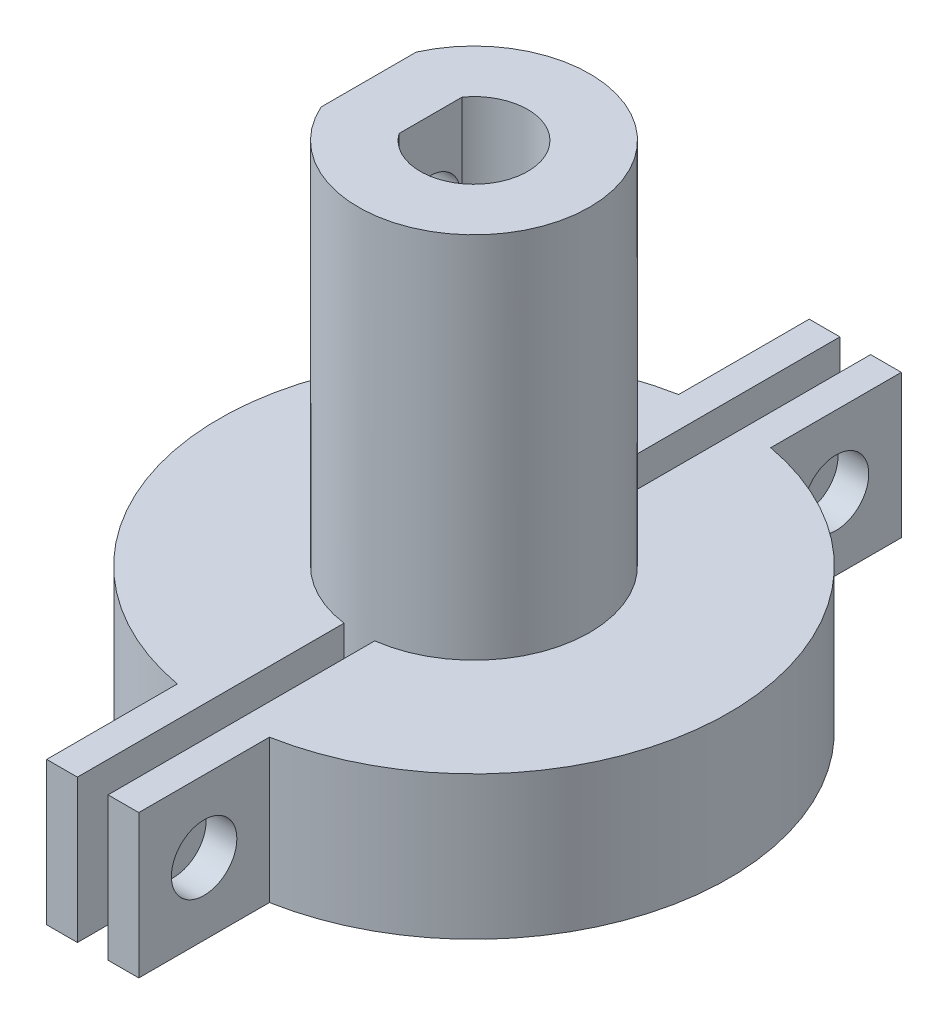
from build123d import *

# Parameters (mm, degrees)
BOSS_EXTRUDE1_DEPTH = 18
SKETCH2_R           = 12.45
SKETCH2_R_2         = 9.45
BOSS_EXTRUDE2_DEPTH = 7
SKETCH3_R           = 12.45
BOSS_EXTRUDE3_DEPTH = 2
CUT_EXTRUDE1_REACH  = 30.085
SKETCH4_R           = 1.45
CUT_EXTRUDE3_REACH  = 32.578
BOSS_EXTRUDE5_START = -7
BOSS_EXTRUDE5_DEPTH = 7
SKETCH8_R           = 1.6
CUT_EXTRUDE4_DEPTH  = 30.783714089
CUT_EXTRUDE5_DEPTH  = 29.739904748


with BuildPart() as part:
    # Sketch1 → Boss-Extrude1 (new body)
    with BuildSketch(Plane(origin=(0, 0, 0), x_dir=(1, 0, 0), z_dir=(0, 1, 0))):
        with BuildLine():
            Line((-5.149418526, 2.325078245), (-5.149418526, -2.325078245))
            ThreePointArc((-5.149418526, -2.325078245), (5.65, 0), (-5.149418526, 2.325078245))
        make_face()
        with BuildLine():
            Line((-2.124418526, 1.541904967), (-2.124418526, -1.541904967))
            ThreePointArc((-2.124418526, -1.541904967), (2.625, 0), (-2.124418526, 1.541904967))
        make_face(mode=Mode.SUBTRACT)
    extrude(amount=BOSS_EXTRUDE1_DEPTH)



with BuildPart() as body_2:
    # Sketch2 → Boss-Extrude2 (new body)
    with BuildSketch(Plane.XZ):
        with Locations(Location((0, 0, 0), (0, 0, 270))):
            Circle(SKETCH2_R)
        with Locations(Location((0, 0, 0), (0, 0, 270))):
            Circle(SKETCH2_R_2, mode=Mode.SUBTRACT)
    extrude(amount=BOSS_EXTRUDE2_DEPTH)


with BuildPart() as part_1:
    add(part.part)

    add(body_2.part)  # Boss-Extrude3 merges body 2
    # Sketch3 → Boss-Extrude3 (add)
    with BuildSketch(Plane.XZ):
        with Locations(Location((0, 0, 0), (0, 0, 270))):
            Circle(SKETCH3_R)
    extrude(amount=BOSS_EXTRUDE3_DEPTH)

    # Sketch4 → Cut-Extrude1 (cut, up to next)
    with BuildSketch(Plane.ZY.offset(5.149418526), mode=Mode.PRIVATE) as cut_extrude1_sk1:
        with Locations((0, 14)):
            Circle(SKETCH4_R)
    cut_extrude1_tool1 = extrude(cut_extrude1_sk1.sketch, amount=-CUT_EXTRUDE1_REACH, mode=Mode.PRIVATE) & part_1.part
    # Sketch4 → Cut-Extrude1 (cut, up to next)
    with BuildSketch(Plane.ZY.offset(5.149418526), mode=Mode.PRIVATE) as cut_extrude1_sk2:
        with Locations((0, 4)):
            Circle(SKETCH4_R)
    cut_extrude1_tool2 = extrude(cut_extrude1_sk2.sketch, amount=-CUT_EXTRUDE1_REACH, mode=Mode.PRIVATE) & part_1.part
    add(cut_extrude1_tool1.solids().sort_by_distance((-5.149419, 14, 0))[0], mode=Mode.SUBTRACT)
    add(cut_extrude1_tool2.solids().sort_by_distance((-5.149419, 4, 0))[0], mode=Mode.SUBTRACT)

    # Sketch6 → Cut-Extrude3 (cut, up to next)
    with BuildSketch(Plane.XZ.offset(7), mode=Mode.PRIVATE) as cut_extrude3_sk1:
        with BuildLine():
            Line((0.75, 9.420191081), (0.75, 12.427389106))
            ThreePointArc((0.75, 12.427389106), (0, 12.45), (-0.75, 12.427389106))
            Line((-0.75, 12.427389106), (-0.75, 9.420191081))
            ThreePointArc((-0.75, 9.420191081), (0, 9.45), (0.75, 9.420191081))
        make_face()
    cut_extrude3_tool1 = extrude(cut_extrude3_sk1.sketch, amount=-CUT_EXTRUDE3_REACH, mode=Mode.PRIVATE) & part_1.part
    # Sketch6 → Cut-Extrude3 (cut, up to next)
    with BuildSketch(Plane.XZ.offset(7), mode=Mode.PRIVATE) as cut_extrude3_sk2:
        with BuildLine():
            Line((0.75, -9.420191081), (0.75, -12.427389106))
            ThreePointArc((0.75, -12.427389106), (0, -12.45), (-0.75, -12.427389106))
            Line((-0.75, -12.427389106), (-0.75, -9.420191081))
            ThreePointArc((-0.75, -9.420191081), (0, -9.45), (0.75, -9.420191081))
        make_face()
    cut_extrude3_tool2 = extrude(cut_extrude3_sk2.sketch, amount=-CUT_EXTRUDE3_REACH, mode=Mode.PRIVATE) & part_1.part
    add(cut_extrude3_tool1.solids().sort_by_distance((0, -7, 10.941262))[0], mode=Mode.SUBTRACT)
    add(cut_extrude3_tool2.solids().sort_by_distance((0, -7, -10.941262))[0], mode=Mode.SUBTRACT)

    # Sketch7 → Boss-Extrude5 (add)
    with BuildSketch(Plane.XZ.offset(7).offset(BOSS_EXTRUDE5_START)):
        with BuildLine():
            Line((-0.75, 12.427389106), (-0.75, 18.627389106))
            Line((-0.75, 18.627389106), (-2.25, 18.627389106))
            Line((-2.25, 18.627389106), (-2.25, 12.244998979))
            ThreePointArc((-2.25, 12.244998979), (-1.502769623, 12.35897178), (-0.75, 12.427389106))
        make_face()
        with BuildLine():
            Line((2.25, 18.627389106), (2.25, 12.244998979))
            ThreePointArc((2.25, 12.244998979), (1.502769623, 12.35897178), (0.75, 12.427389106))
            Line((0.75, 12.427389106), (0.75, 18.627389106))
            Line((0.75, 18.627389106), (2.25, 18.627389106))
        make_face()
        with BuildLine():
            Line((0.75, -12.427389106), (0.75, -18.627389106))
            Line((0.75, -18.627389106), (2.25, -18.627389106))
            Line((2.25, -18.627389106), (2.25, -12.244998979))
            ThreePointArc((2.25, -12.244998979), (1.502769623, -12.35897178), (0.75, -12.427389106))
        make_face()
        with BuildLine():
            Line((-2.25, -18.627389106), (-2.25, -12.244998979))
            ThreePointArc((-2.25, -12.244998979), (-1.502769623, -12.35897178), (-0.75, -12.427389106))
            Line((-0.75, -12.427389106), (-0.75, -18.627389106))
            Line((-0.75, -18.627389106), (-2.25, -18.627389106))
        make_face()
    extrude(amount=BOSS_EXTRUDE5_DEPTH)

    # Sketch8 → Cut-Extrude4 (cut, through all)
    with BuildSketch(Plane.ZY.offset(2.25)):
        with Locations(Location((-15.436194043, -3.5, 0), (0, 0, 180))):
            Circle(SKETCH8_R)
        with Locations(Location((15.436194043, -3.5, 0), (0, 0, 180))):
            Circle(SKETCH8_R)
    extrude(amount=-CUT_EXTRUDE4_DEPTH, mode=Mode.SUBTRACT)

    # Sketch9 → Cut-Extrude5 (cut, through all)
    with BuildSketch(Plane(origin=(0, 0, 0), x_dir=(1, 0, 0), z_dir=(0, 1, 0))):
        with BuildLine():
            Line((-0.75, -9.420191081), (-0.75, -5.6))
            ThreePointArc((-0.75, -5.6), (0, -5.65), (0.75, -5.6))
            Line((0.75, -5.6), (0.75, -9.420191081))
            ThreePointArc((0.75, -9.420191081), (0, -9.45), (-0.75, -9.420191081))
        make_face()
        with BuildLine():
            Line((-0.75, 5.6), (-0.75, 9.420191081))
            ThreePointArc((-0.75, 9.420191081), (0, 9.45), (0.75, 9.420191081))
            Line((0.75, 9.420191081), (0.75, 5.6))
            ThreePointArc((0.75, 5.6), (0, 5.65), (-0.75, 5.6))
        make_face()
    extrude(amount=-CUT_EXTRUDE5_DEPTH, mode=Mode.SUBTRACT)


solid = part_1.part
